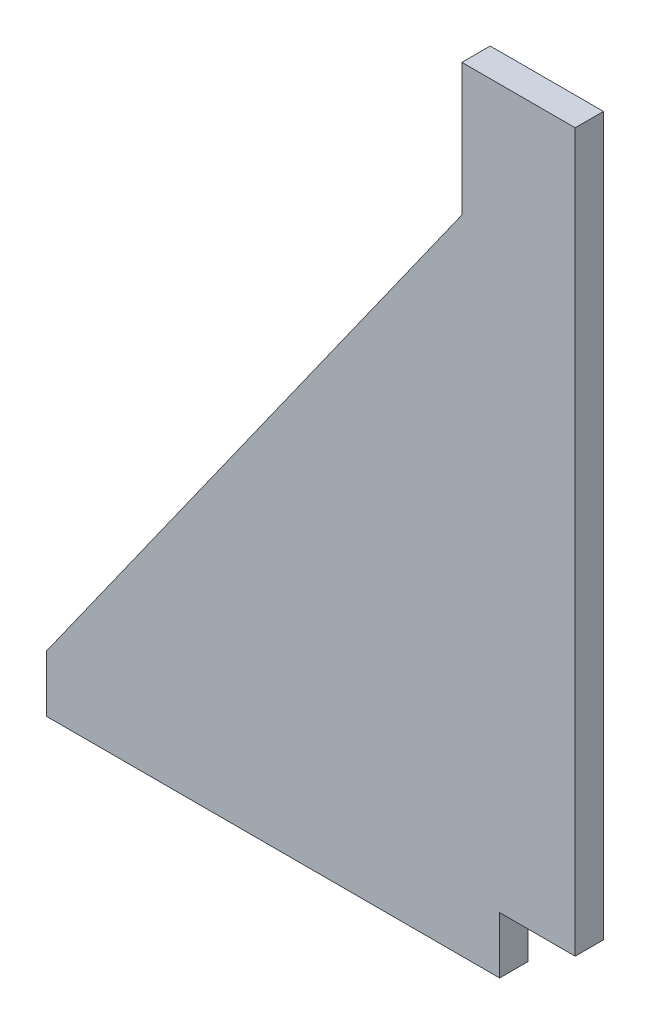
from build123d import *

# Parameters (mm, degrees)
BOSS_EXTRUDE1_DEPTH = 9.525


with BuildPart() as part:
    # Sketch1 → Boss-Extrude1 (new, symmetric)
    with BuildSketch(Plane.XY):
        Polygon((0, 0), (304.8, 0), (304.8, 38.1), (355.6, 38.1), (355.6, 520.7), (279.4, 520.7), (279.4, 431.8), (0, 38.1), align=None)
    extrude(amount=BOSS_EXTRUDE1_DEPTH, both=True)


solid = part.part
